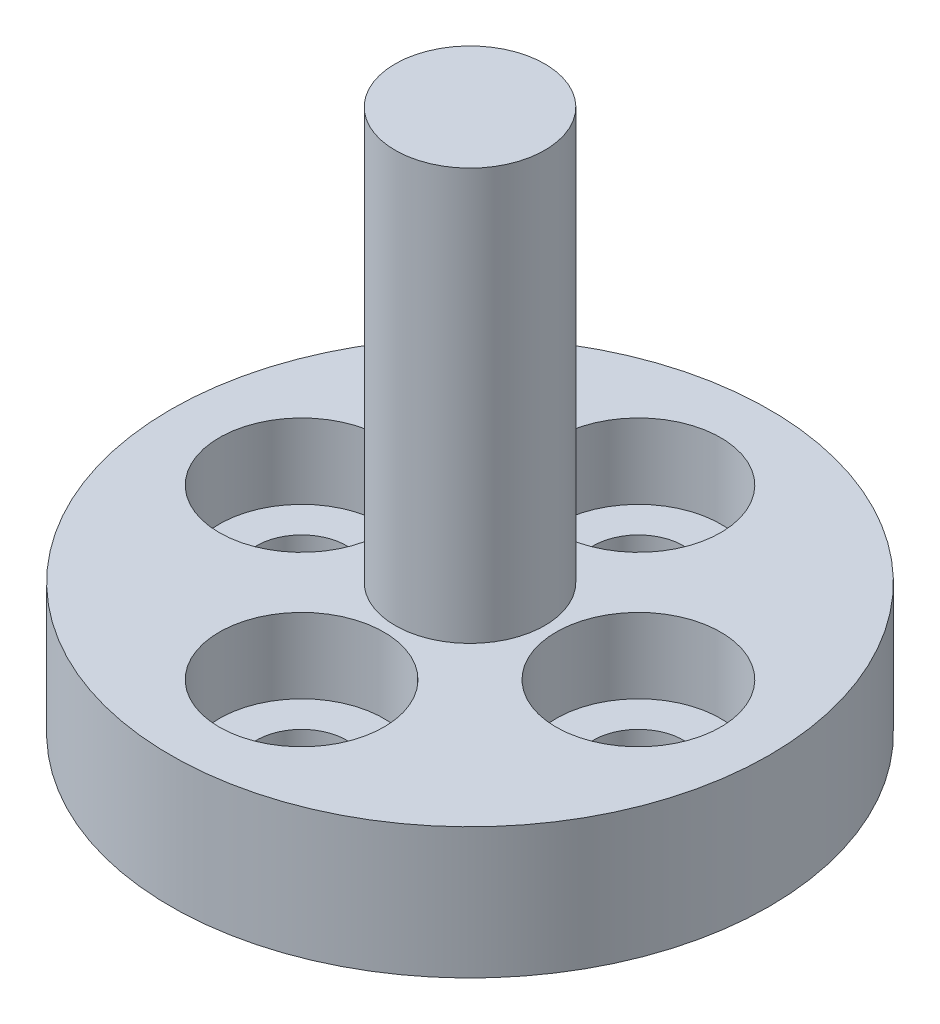
from build123d import *

# Parameters (mm, degrees)
CBORE_FOR_M2_SHCS1_D           = 2.4
CBORE_FOR_M2_SHCS1_CBORE_D     = 4.4
CBORE_FOR_M2_SHCS1_CBORE_DEPTH = 2


with BuildPart() as part:
    # Sketch1 → Revolve1 (revolve)
    with BuildSketch(Plane.XY, mode=Mode.PRIVATE) as revolve1_sk:
        Polygon((0, 0), (8, 0), (8, 3.5), (2, 3.5), (2, 14.5), (0, 14.5), align=None)
    revolve(revolve1_sk.sketch.rotate(Axis((0, 14.5, 0), (0, -1, 0)), 180), axis=Axis((0, 14.5, 0), (0, -1, 0)))

    # CBORE for M2 SHCS1 (through all)
    with Locations(Plane(origin=(0, 3.5, 0), x_dir=(1, 0, 0), z_dir=(0, 1, 0))):
        with Locations((-4.5, 0), (0, 4.5), (4.5, 0), (0, -4.5)):
            CounterBoreHole(CBORE_FOR_M2_SHCS1_D / 2, CBORE_FOR_M2_SHCS1_CBORE_D / 2, CBORE_FOR_M2_SHCS1_CBORE_DEPTH)


solid = part.part
